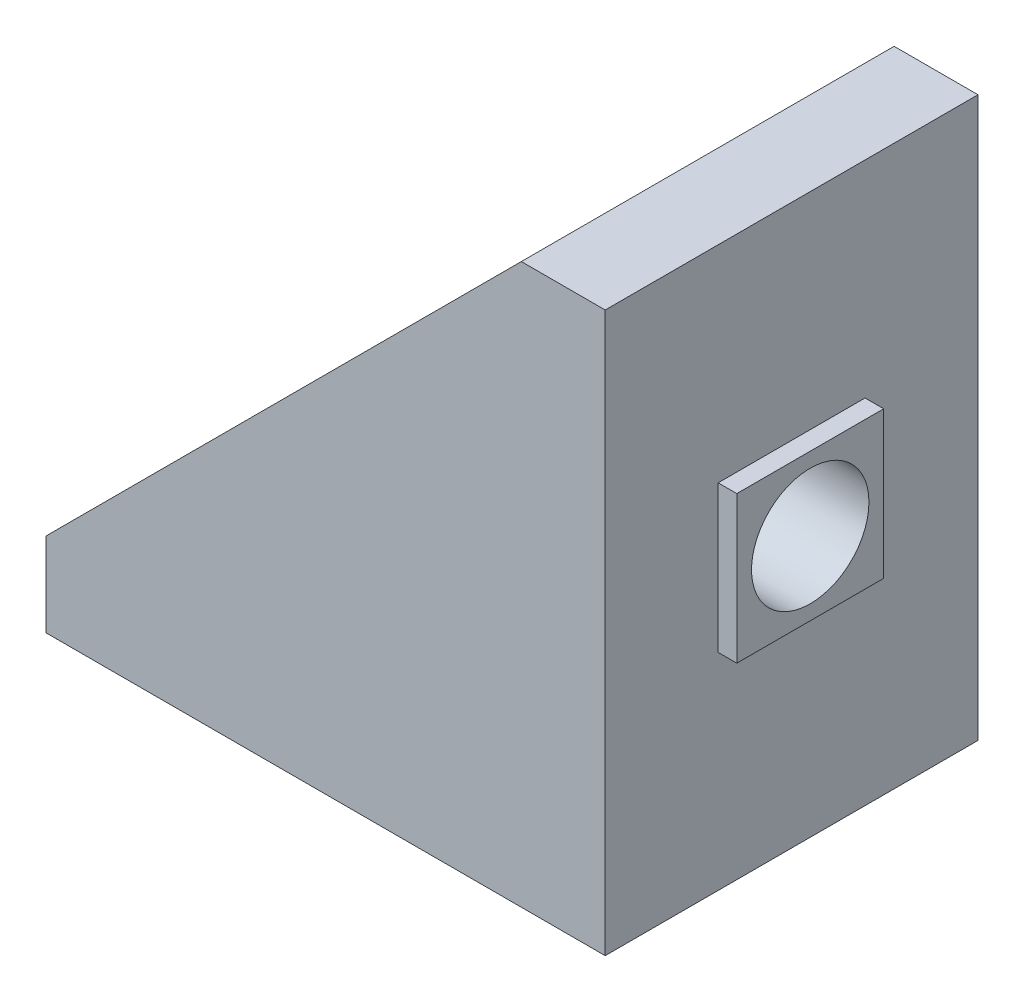
from build123d import *

# Parameters (mm, degrees)
BOSS_EXTRUDE1_DEPTH = 20
CUT_EXTRUDE1_START  = -2
CUT_EXTRUDE1_DEPTH  = 16
SKETCH3_W           = 7.88
SKETCH3_H           = 7.88
BOSS_EXTRUDE2_DEPTH = 1
SKETCH4_R           = 3.15
CUT_EXTRUDE2_DEPTH  = 48.549973712
SKETCH5_W           = 2
SKETCH5_H           = 7.7
SKETCH5_W_2         = 5
BOSS_EXTRUDE3_DEPTH = 1
SKETCH6_R           = 3.15
CUT_EXTRUDE3_DEPTH  = 47.904157598


with BuildPart() as part:
    # Sketch1 → Boss-Extrude1 (new body)
    with BuildSketch(Plane.XY):
        Polygon((0, 0), (0, 30), (-4.5, 30), (-30, 4.5), (-30, 0), align=None)
    extrude(amount=BOSS_EXTRUDE1_DEPTH)

    # Sketch2 → Cut-Extrude1 (cut)
    with BuildSketch(Plane.XY.offset(20).offset(CUT_EXTRUDE1_START)):
        Polygon((-30, 4.5), (-4.5, 4.5), (-4.5, 30), align=None)
    extrude(amount=-CUT_EXTRUDE1_DEPTH, mode=Mode.SUBTRACT)

    # Sketch3 → Boss-Extrude2 (add)
    with BuildSketch(Plane(origin=(0, 0, 0), x_dir=(0, 0, -1), z_dir=(1, 0, 0))):
        with Locations((-10, 15)):
            Rectangle(SKETCH3_W, SKETCH3_H)
    extrude(amount=BOSS_EXTRUDE2_DEPTH)

    # Sketch4 → Cut-Extrude2 (cut, through all)
    with BuildSketch(Plane(origin=(1, 0, 0), x_dir=(0, 0, -1), z_dir=(1, 0, 0))):
        with Locations((-10, 15)):
            Circle(SKETCH4_R)
    extrude(amount=-CUT_EXTRUDE2_DEPTH, mode=Mode.SUBTRACT)

    # Sketch5 → Boss-Extrude3 (add)
    with BuildSketch(Plane.XZ):
        with Locations((-24.8, 10)):
            Rectangle(SKETCH5_W, SKETCH5_H)
        with Locations((-7.1, 10)):
            Rectangle(SKETCH5_W_2, SKETCH5_H)
    extrude(amount=BOSS_EXTRUDE3_DEPTH)

    # Sketch6 → Cut-Extrude3 (cut, through all)
    with BuildSketch(Plane.XZ):
        with Locations(Location((-18, 10, 0), (0, 0, 270))):
            Circle(SKETCH6_R)
    extrude(amount=-CUT_EXTRUDE3_DEPTH, mode=Mode.SUBTRACT)


solid = part.part
